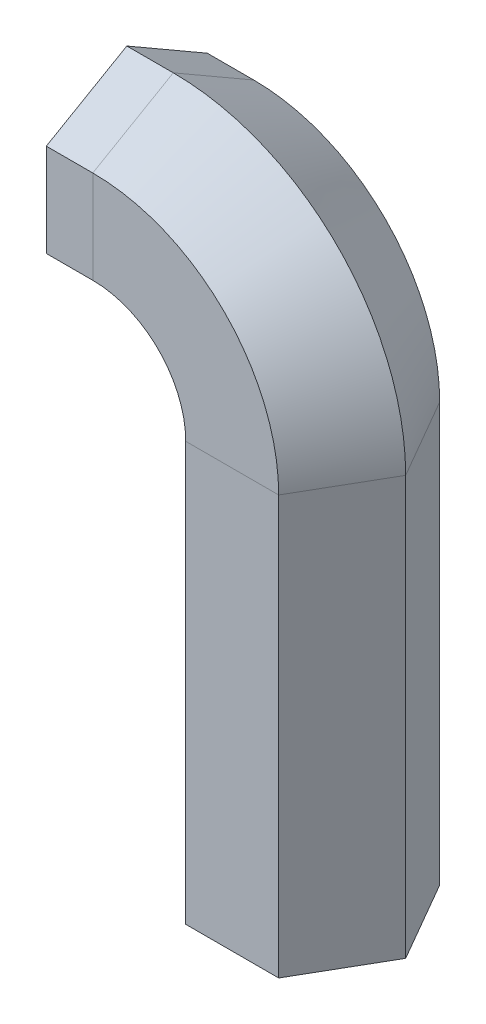
from build123d import *


with BuildPart() as part:
    # Sweep3: sweep along a path in Sketch5
    with BuildLine(Plane.XY) as sweep3_path:
        Line((0, 0), (0, 90))
        ThreePointArc((0, 90), (-8.786796564, 111.213203436), (-30, 120))
        Line((-30, 120), (-40, 120))
    # Sketch2 → Sweep3 (sweep)
    with BuildSketch(Plane(origin=(0, 0, 0), x_dir=(1, 0, 0), z_dir=(0, 1, 0))):
        Polygon((10, -17.320508076), (20, 0), (10, 17.320508076), (-10, 17.320508076), (-20, 0), (-10, -17.320508076), align=None)
    sweep(path=sweep3_path.line)


solid = part.part
